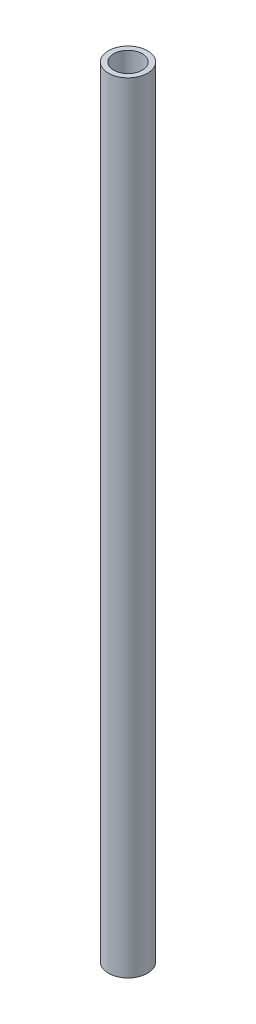
from build123d import *

# Parameters (mm, degrees)
SKETCH1_R           = 0.45085
SKETCH1_R_2         = 0.3302
BOSS_EXTRUDE1_DEPTH = 18


with BuildPart() as part:
    # Sketch1 → Boss-Extrude1 (new body)
    with BuildSketch(Plane(origin=(0, 0, 0), x_dir=(1, 0, 0), z_dir=(0, 1, 0))):
        with Locations(Location((0, 0, 0), (0, 0, 270))):
            Circle(SKETCH1_R)
        with Locations(Location((0, 0, 0), (0, 0, 270))):
            Circle(SKETCH1_R_2, mode=Mode.SUBTRACT)
    extrude(amount=BOSS_EXTRUDE1_DEPTH)


solid = part.part
